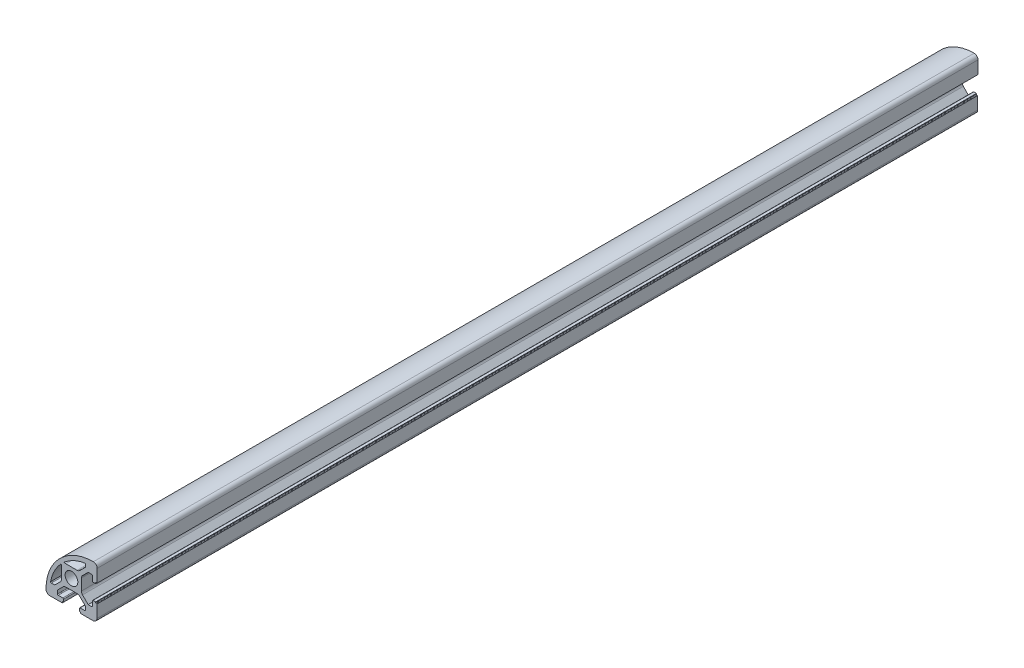
from build123d import *

# Parameters (mm, degrees)
SKETCH_1_R      = 2.5
EXTRUDE_1_DEPTH = 346


with BuildPart() as part:
    # 草图1 → 凸台-拉伸1 (new body)
    with BuildSketch(Plane.XY):
        with BuildLine():
            Line((4.215995631, 3.129161171), (6.436655803, 5.349821343))
            Line((6.436655803, 5.349821343), (7.776655803, 5.349821343))
            ThreePointArc((7.776655803, 5.349821343), (7.988787838, 5.261953377), (8.076655803, 5.049821343))
            Line((8.076655803, 5.049821343), (8.076655803, 3.249821343))
            ThreePointArc((8.076655803, 3.249821343), (8.164523769, 3.037689308), (8.376655803, 2.949821343))
            Line((8.376655803, 2.949821343), (9.376655803, 2.949821343))
            Line((9.376655803, 2.949821343), (9.376655803, 3.249821343))
            ThreePointArc((9.376655803, 3.249821343), (9.435234447, 3.391242699), (9.576655803, 3.449821343))
            Line((9.576655803, 3.449821343), (9.99208048, 3.449821343))
            Line((9.99208048, 3.449821343), (9.99208048, 8.46524602))
            ThreePointArc((9.99208048, 8.46524602), (9.552740652, 9.525906191), (8.49208048, 9.96524602))
            ThreePointArc((8.49208048, 9.96524602), (-4.671012544, 4.512914366), (-10.123344197, -8.650178657))
            ThreePointArc((-10.123344197, -8.650178657), (-9.684004369, -9.710838829), (-8.623344197, -10.150178657))
            Line((-8.623344197, -10.150178657), (-3.723344197, -10.150178657))
            Line((-3.723344197, -10.150178657), (-3.723344197, -9.850178657))
            ThreePointArc((-3.723344197, -9.850178657), (-3.664765553, -9.708757301), (-3.523344197, -9.650178657))
            Line((-3.523344197, -9.650178657), (-3.223344197, -9.650178657))
            Line((-3.223344197, -9.650178657), (-3.223344197, -8.650178657))
            ThreePointArc((-3.223344197, -8.650178657), (-3.311212162, -8.438046623), (-3.523344197, -8.350178657))
            Line((-3.523344197, -8.350178657), (-5.323344197, -8.350178657))
            ThreePointArc((-5.323344197, -8.350178657), (-5.535476231, -8.262310692), (-5.623344197, -8.050178657))
            Line((-5.623344197, -8.050178657), (-5.623344197, -6.710178657))
            Line((-5.623344197, -6.710178657), (-3.402684025, -4.489518485))
            ThreePointArc((-3.402684025, -4.489518485), (-2.916049002, -4.164359358), (-2.342023853, -4.050178657))
            Line((-2.342023853, -4.050178657), (2.09533546, -4.050178657))
            ThreePointArc((2.09533546, -4.050178657), (2.669360608, -4.164359358), (3.155995631, -4.489518485))
            Line((3.155995631, -4.489518485), (5.376655803, -6.710178657))
            Line((5.376655803, -6.710178657), (5.376655803, -8.050178657))
            ThreePointArc((5.376655803, -8.050178657), (5.288787838, -8.262310692), (5.076655803, -8.350178657))
            Line((5.076655803, -8.350178657), (3.276655803, -8.350178657))
            ThreePointArc((3.276655803, -8.350178657), (3.064523769, -8.438046623), (2.976655803, -8.650178657))
            Line((2.976655803, -8.650178657), (2.976655803, -9.650178657))
            Line((2.976655803, -9.650178657), (3.276655803, -9.650178657))
            ThreePointArc((3.276655803, -9.650178657), (3.418077159, -9.708757301), (3.476655803, -9.850178657))
            Line((3.476655803, -9.850178657), (3.476655803, -10.150178657))
            Line((3.476655803, -10.150178657), (8.376655803, -10.150178657))
            ThreePointArc((8.376655803, -10.150178657), (9.437315975, -9.710838829), (9.876655803, -8.650178657))
            Line((9.876655803, -8.650178657), (9.876655803, -3.750178657))
            Line((9.876655803, -3.750178657), (9.576655803, -3.750178657))
            ThreePointArc((9.576655803, -3.750178657), (9.435234447, -3.691600013), (9.376655803, -3.550178657))
            Line((9.376655803, -3.550178657), (9.376655803, -3.250178657))
            Line((9.376655803, -3.250178657), (8.376655803, -3.250178657))
            ThreePointArc((8.376655803, -3.250178657), (8.164523769, -3.338046623), (8.076655803, -3.550178657))
            Line((8.076655803, -3.550178657), (8.076655803, -5.350178657))
            ThreePointArc((8.076655803, -5.350178657), (7.988787838, -5.562310692), (7.776655803, -5.650178657))
            Line((7.776655803, -5.650178657), (6.436655803, -5.650178657))
            Line((6.436655803, -5.650178657), (4.215995631, -3.429518485))
            ThreePointArc((4.215995631, -3.429518485), (3.890836504, -2.942883462), (3.776655803, -2.368858314))
            Line((3.776655803, -2.368858314), (3.776655803, 2.068500999))
            ThreePointArc((3.776655803, 2.068500999), (3.890836504, 2.642526148), (4.215995631, 3.129161171))
        make_face()
        with Locations((-0.123344197, -0.035109627)):
            Circle(SKETCH_1_R, mode=Mode.SUBTRACT)
        with BuildLine():
            Line((5.376655803, 7.864890373), (5.376655803, 6.524890373))
            Line((5.376655803, 6.524890373), (3.155995631, 4.304230202))
            ThreePointArc((3.155995631, 4.304230202), (2.669360608, 3.979071075), (2.09533546, 3.864890373))
            Line((2.09533546, 3.864890373), (-2.342023853, 3.864890373))
            ThreePointArc((-2.342023853, 3.864890373), (-2.69419221, 3.906817176), (-3.026673509, 4.030253775))
            ThreePointArc((-3.026673509, 4.030253775), (0.896523465, 6.557813899), (5.376655803, 7.864890373))
        make_face(mode=Mode.SUBTRACT)
        with BuildLine():
            Line((-4.023344197, 2.18357003), (-4.023344197, -2.253789283))
            ThreePointArc((-4.023344197, -2.253789283), (-4.137524898, -2.827814432), (-4.462684025, -3.314449455))
            Line((-4.462684025, -3.314449455), (-6.683344197, -5.535109627))
            Line((-6.683344197, -5.535109627), (-8.023344197, -5.535109627))
            ThreePointArc((-8.023344197, -5.535109627), (-8.235476231, -5.447241661), (-8.323344197, -5.235109627))
            ThreePointArc((-8.323344197, -5.235109627), (-6.845791054, -0.874365796), (-4.203440462, 2.89620888))
            ThreePointArc((-4.203440462, 2.89620888), (-4.069065062, 2.551091728), (-4.023344197, 2.18357003))
        make_face(mode=Mode.SUBTRACT)
    extrude(amount=EXTRUDE_1_DEPTH)


solid = part.part
